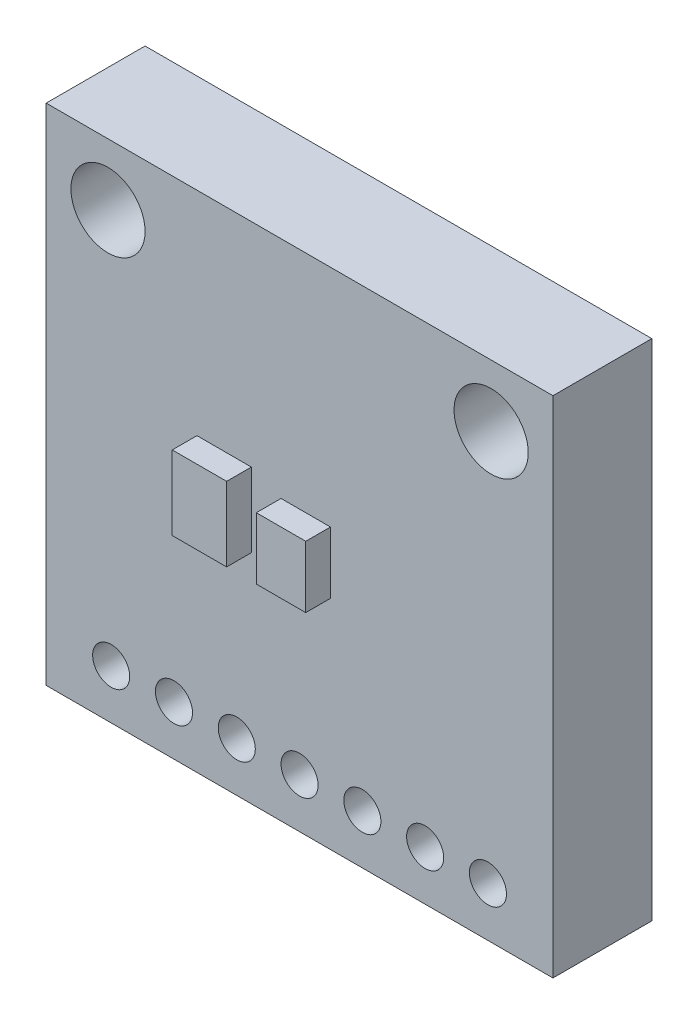
from build123d import *

# Parameters (mm, degrees)
ESQUISSE2_W             = 20.5
ESQUISSE2_H             = 20.4
BOSS_EXTRU_1_DEPTH      = 4
ESQUISSE3_R             = 1.5
ESQUISSE3_R_2           = 0.75
ENL_V_MAT_EXTRU_1_DEPTH = 4
ESQUISSE4_W             = 2.2
ESQUISSE4_H             = 3
ESQUISSE4_W_2           = 2
ESQUISSE4_H_2           = 2.5
BOSS_EXTRU_2_DEPTH      = 1


with BuildPart() as part:
    # Esquisse2 → Boss.-Extru.1 (new body)
    with BuildSketch(Plane.XY):
        with Locations((10.25, 10.2)):
            Rectangle(ESQUISSE2_W, ESQUISSE2_H)
    extrude(amount=-BOSS_EXTRU_1_DEPTH)

    # Esquisse3 → Enlèv. mat.-Extru.1 (cut)
    with BuildSketch(Plane.XY):
        with Locations((2.5, 17.9)):
            Circle(ESQUISSE3_R)
        with Locations((18, 17.9)):
            Circle(ESQUISSE3_R)
        with Locations((2.63, 2)):
            Circle(ESQUISSE3_R_2)
        with Locations((5.17, 2)):
            Circle(ESQUISSE3_R_2)
        with Locations((7.71, 2)):
            Circle(ESQUISSE3_R_2)
        with Locations((10.25, 2)):
            Circle(ESQUISSE3_R_2)
        with Locations((12.79, 2)):
            Circle(ESQUISSE3_R_2)
        with Locations((15.33, 2)):
            Circle(ESQUISSE3_R_2)
        with Locations((17.87, 2)):
            Circle(ESQUISSE3_R_2)
    extrude(amount=-ENL_V_MAT_EXTRU_1_DEPTH, mode=Mode.SUBTRACT)

    # Esquisse4 → Boss.-Extru.2 (add)
    with BuildSketch(Plane.XY):
        with Locations((7.2, 10.3)):
            Rectangle(ESQUISSE4_W, ESQUISSE4_H)
        with Locations((10.5, 10.05)):
            Rectangle(ESQUISSE4_W_2, ESQUISSE4_H_2)
    extrude(amount=BOSS_EXTRU_2_DEPTH)


solid = part.part
